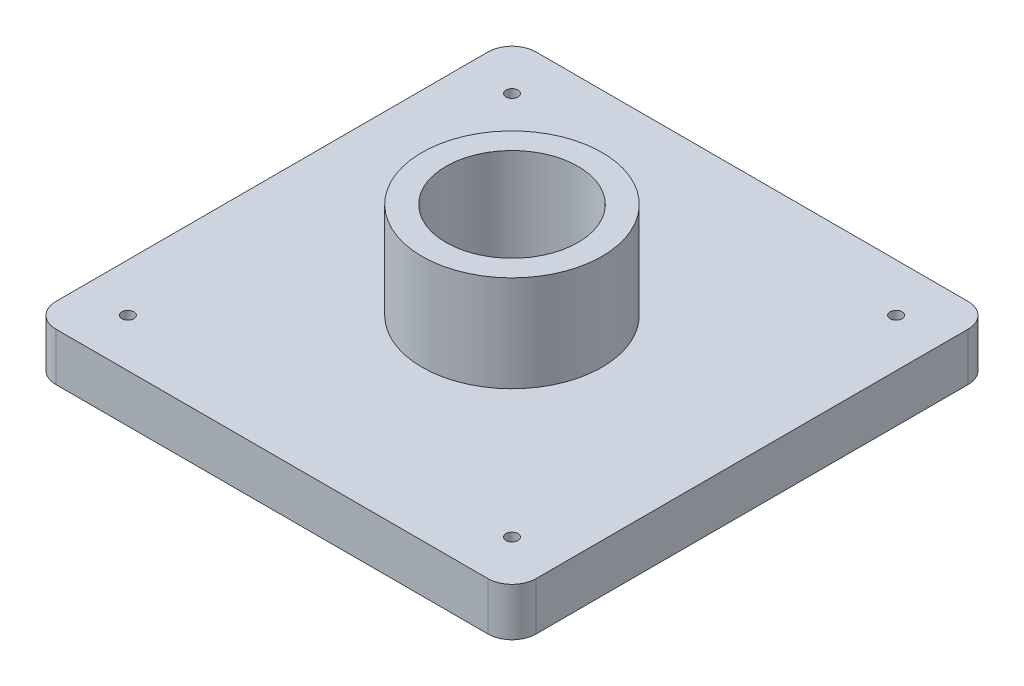
from build123d import *

# Parameters (mm, degrees)
BOSS_EXTRUDE1_DEPTH = 20
SKETCH2_R           = 37.5
BOSS_EXTRUDE2_DEPTH = 40
CUT_EXTRUDE1_REACH  = 148.969
SKETCH3_R           = 2.5
SKETCH4_R           = 27.5
CUT_EXTRUDE2_DEPTH  = 154.622914957


with BuildPart() as part:
    # Sketch1 → Boss-Extrude1 (new body)
    with BuildSketch(Plane(origin=(0, 0, 0), x_dir=(1, 0, 0), z_dir=(0, 1, 0))):
        with BuildLine():
            Line((-90, -100), (90, -100))
            ThreePointArc((90, -100), (97.071067812, -97.071067812), (100, -90))
            Line((100, -90), (100, 90))
            ThreePointArc((100, 90), (97.071067812, 97.071067812), (90, 100))
            Line((90, 100), (-90, 100))
            ThreePointArc((-90, 100), (-97.071067812, 97.071067812), (-100, 90))
            Line((-100, 90), (-100, -90))
            ThreePointArc((-100, -90), (-97.071067812, -97.071067812), (-90, -100))
        make_face()
    extrude(amount=BOSS_EXTRUDE1_DEPTH)

    # Sketch2 → Boss-Extrude2 (add)
    with BuildSketch(Plane(origin=(0, 20, 0), x_dir=(1, 0, 0), z_dir=(0, 1, 0))):
        with Locations(Location((0, 0, 0), (0, 0, 270))):
            Circle(SKETCH2_R)
    extrude(amount=BOSS_EXTRUDE2_DEPTH)

    # Sketch3 → Cut-Extrude1 (cut, up to next)
    with BuildSketch(Plane(origin=(0, 20, 0), x_dir=(1, 0, 0), z_dir=(0, 1, 0)), mode=Mode.PRIVATE) as cut_extrude1_sk1:
        with Locations(Location((-80, 80, 0), (0, 0, 270))):
            Circle(SKETCH3_R)
    cut_extrude1_tool1 = extrude(cut_extrude1_sk1.sketch, amount=-CUT_EXTRUDE1_REACH, mode=Mode.PRIVATE) & part.part
    # Sketch3 → Cut-Extrude1 (cut, up to next)
    with BuildSketch(Plane(origin=(0, 20, 0), x_dir=(1, 0, 0), z_dir=(0, 1, 0)), mode=Mode.PRIVATE) as cut_extrude1_sk2:
        with Locations(Location((80, 80, 0), (0, 0, 270))):
            Circle(SKETCH3_R)
    cut_extrude1_tool2 = extrude(cut_extrude1_sk2.sketch, amount=-CUT_EXTRUDE1_REACH, mode=Mode.PRIVATE) & part.part
    # Sketch3 → Cut-Extrude1 (cut, up to next)
    with BuildSketch(Plane(origin=(0, 20, 0), x_dir=(1, 0, 0), z_dir=(0, 1, 0)), mode=Mode.PRIVATE) as cut_extrude1_sk3:
        with Locations(Location((80, -80, 0), (0, 0, 270))):
            Circle(SKETCH3_R)
    cut_extrude1_tool3 = extrude(cut_extrude1_sk3.sketch, amount=-CUT_EXTRUDE1_REACH, mode=Mode.PRIVATE) & part.part
    # Sketch3 → Cut-Extrude1 (cut, up to next)
    with BuildSketch(Plane(origin=(0, 20, 0), x_dir=(1, 0, 0), z_dir=(0, 1, 0)), mode=Mode.PRIVATE) as cut_extrude1_sk4:
        with Locations(Location((-80, -80, 0), (0, 0, 270))):
            Circle(SKETCH3_R)
    cut_extrude1_tool4 = extrude(cut_extrude1_sk4.sketch, amount=-CUT_EXTRUDE1_REACH, mode=Mode.PRIVATE) & part.part
    add(cut_extrude1_tool1.solids().sort_by_distance((-80, 20, -80))[0], mode=Mode.SUBTRACT)
    add(cut_extrude1_tool2.solids().sort_by_distance((80, 20, -80))[0], mode=Mode.SUBTRACT)
    add(cut_extrude1_tool3.solids().sort_by_distance((80, 20, 80))[0], mode=Mode.SUBTRACT)
    add(cut_extrude1_tool4.solids().sort_by_distance((-80, 20, 80))[0], mode=Mode.SUBTRACT)

    # Sketch4 → Cut-Extrude2 (cut, through all)
    with BuildSketch(Plane(origin=(0, 60, 0), x_dir=(1, 0, 0), z_dir=(0, 1, 0))):
        with Locations(Location((0, 0, 0), (0, 0, 270))):
            Circle(SKETCH4_R)
    extrude(amount=-CUT_EXTRUDE2_DEPTH, mode=Mode.SUBTRACT)


solid = part.part
